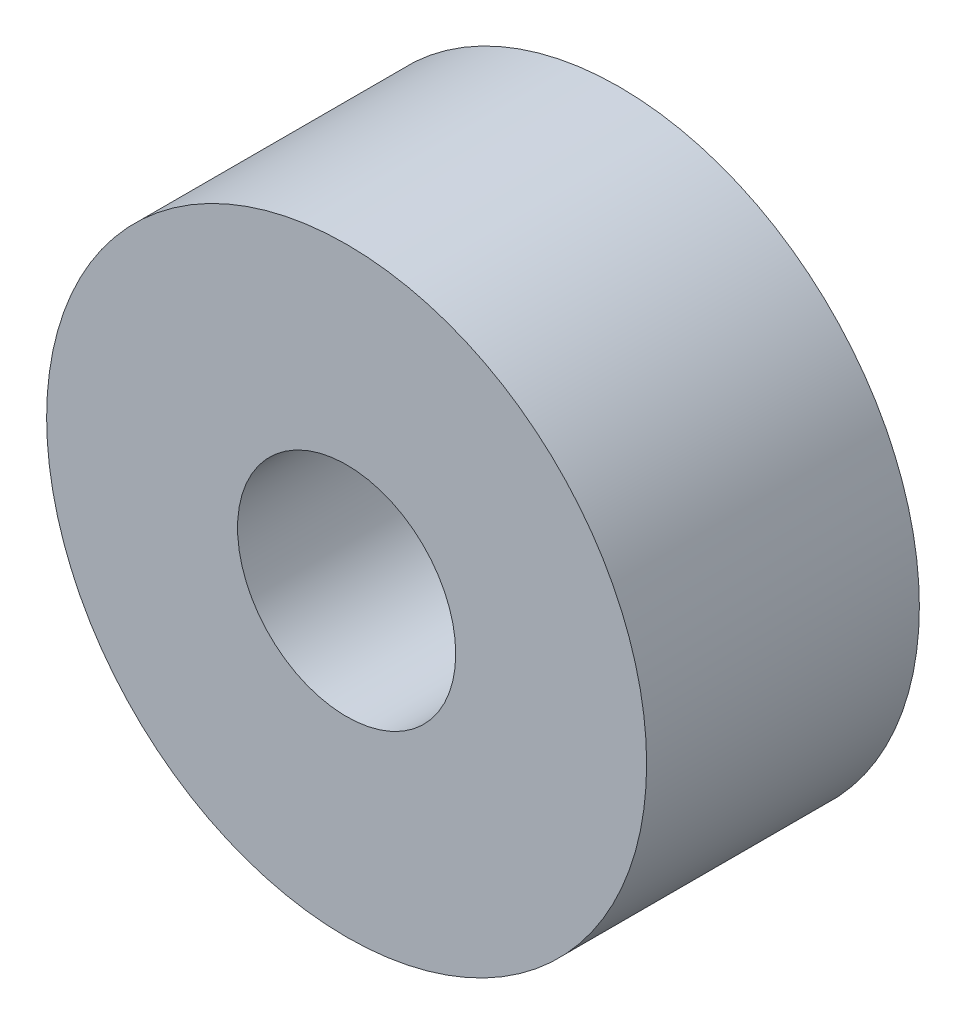
from build123d import *

# Parameters (mm, degrees)
SKETCH1_R           = 11
SKETCH1_R_2         = 4
BOSS_EXTRUDE1_DEPTH = 10


with BuildPart() as part:
    # Sketch1 → Boss-Extrude1 (new body)
    with BuildSketch(Plane.XY):
        Circle(SKETCH1_R)
        Circle(SKETCH1_R_2, mode=Mode.SUBTRACT)
    extrude(amount=BOSS_EXTRUDE1_DEPTH)


solid = part.part
